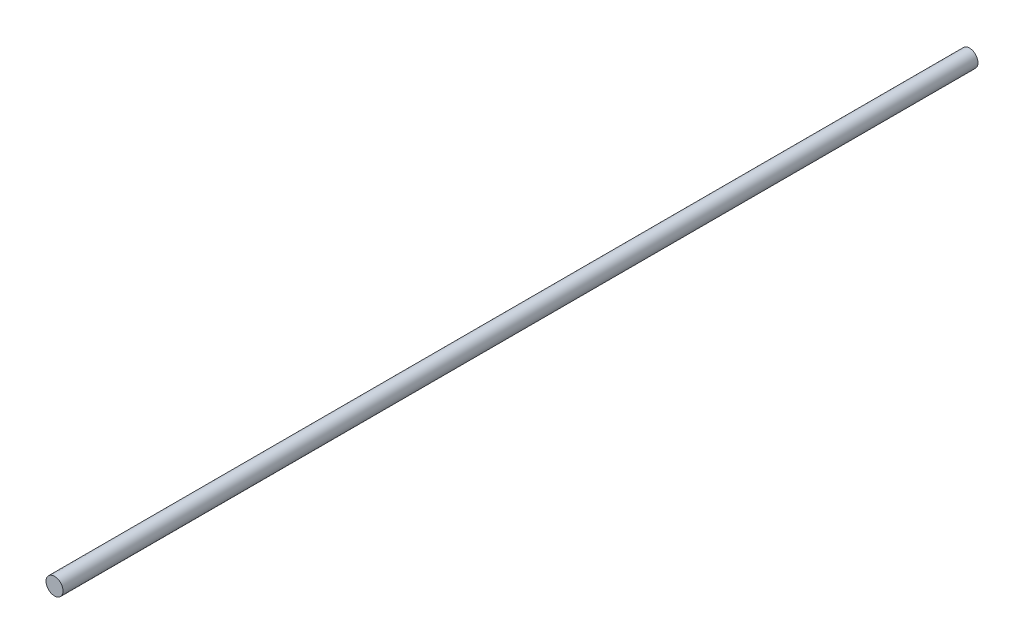
from build123d import *

# Parameters (mm, degrees)
SKETCH1_R           = 4
BOSS_EXTRUDE1_DEPTH = 430


with BuildPart() as part:
    # Sketch1 → Boss-Extrude1 (new body)
    with BuildSketch(Plane.XY):
        with Locations(Location((0, 0, 0), (0, 0, 180))):
            Circle(SKETCH1_R)
    extrude(amount=BOSS_EXTRUDE1_DEPTH)


solid = part.part
